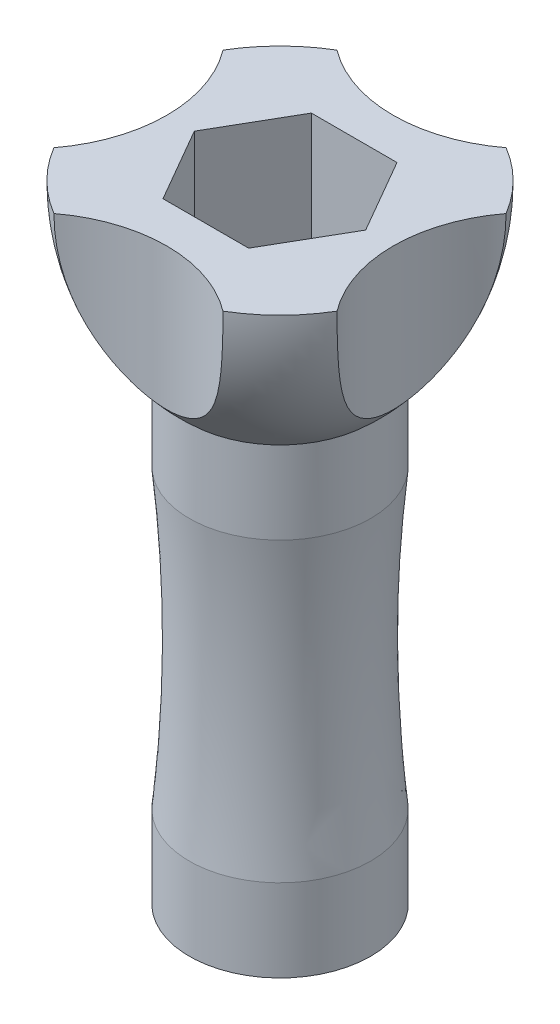
from build123d import *

# Parameters (mm, degrees)
SKETCH2_R                = 8.5
CUT_EXTRUDE1_DEPTH       = 10
CIRPATTERN1_COUNT        = 4
CUT_EXTRUDE2_DEPTH       = 12
F_4_0_4_DIAMETER_HOLE1_D = 4


with BuildPart() as part:
    # Sketch1 → Revolve3 (revolve)
    with BuildSketch(Plane.XY):
        with BuildLine():
            Line((0, 81.005557052), (-10, 81.005557052))
            ThreePointArc((-10, 81.005557052), (-8.823173444, 75.522629002), (-5.5, 71.005557052))
            Line((-5.5, 71.005557052), (-5.5, 66.005557052))
            add(Edge.make_bspline(
                [(-5.5, 66.005557052), (-4.587686539, 56.99839644), (-5.5, 48.005557052)],
                knots=[0, 0, 0, 1, 1, 1], degree=2))
            Line((-5.5, 48.005557052), (-5.5, 43.005557052))
            Line((-5.5, 43.005557052), (0, 43.005557052))
            Line((0, 43.005557052), (0, 81.005557052))
        make_face()
    revolve(axis=Axis((0, 81.005557052, 0), (0, -1, 0)))

    # Sketch2 → Cut-Extrude1 (cut)
    with BuildSketch(Plane(origin=(0, 81.005557052, 0), x_dir=(1, 0, 0), z_dir=(0, 1, 0))):
        with Locations((0, 15.36427344)):
            Circle(SKETCH2_R)
    cut_extrude1 = extrude(amount=-CUT_EXTRUDE1_DEPTH, mode=Mode.SUBTRACT)

    # CirPattern1: Cut-Extrude1 ×4 about axis
    cirpattern1_axis = Axis((0, 0, 0), (0, 1, 0))
    for i in range(1, CIRPATTERN1_COUNT):
        add(cut_extrude1.rotate(cirpattern1_axis, i * 360 / CIRPATTERN1_COUNT), mode=Mode.SUBTRACT)

    # Sketch3 → Cut-Extrude2 (cut)
    with BuildSketch(Plane(origin=(0, 81.005557052, 0), x_dir=(1, 0, 0), z_dir=(0, 1, 0))):
        Polygon((-2.598076211, 4.5), (-5.196152423, 0), (-2.598076211, -4.5), (2.598076211, -4.5), (5.196152423, 0), (2.598076211, 4.5), align=None)
    extrude(amount=-CUT_EXTRUDE2_DEPTH, mode=Mode.SUBTRACT)

    # Ø4.0 (4) Diameter Hole1 (through all)
    with Locations(Plane(origin=(0, 69.005557052, 0), x_dir=(1, 0, 0), z_dir=(0, 1, 0))):
        with Locations((0, 0)):
            Hole(F_4_0_4_DIAMETER_HOLE1_D / 2)


solid = part.part
